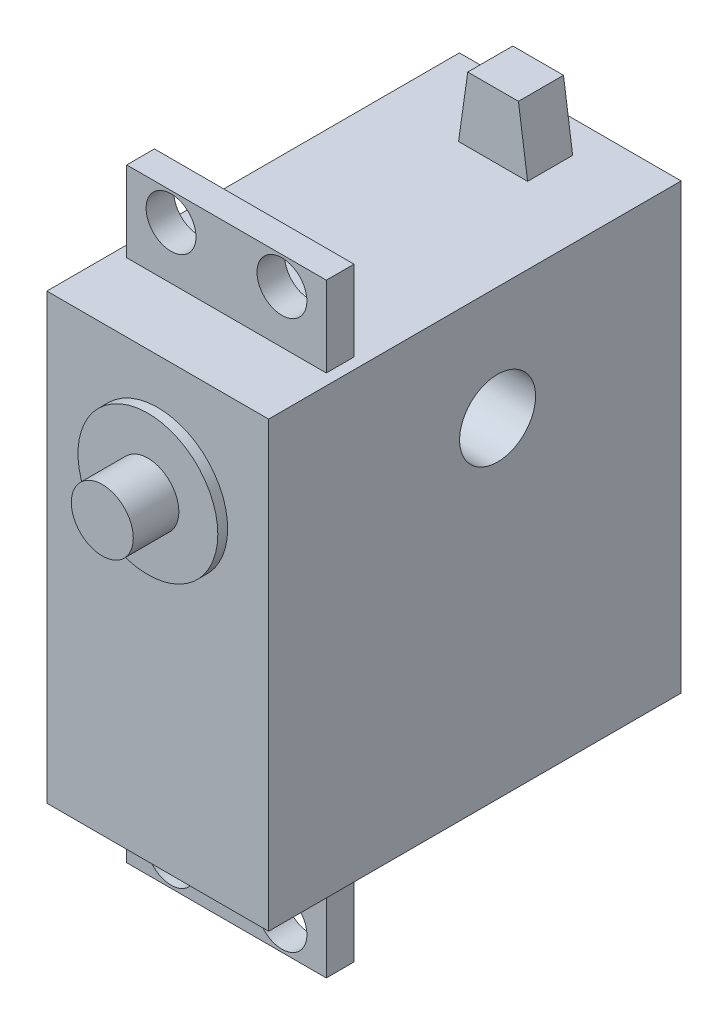
from build123d import *

# Parameters (mm, degrees)
SKETCH1_W           = 20
SKETCH1_H           = 40
BOSS_EXTRUDE1_DEPTH = 8.7
SKETCH2_W           = 20
SKETCH2_H           = 40
BOSS_EXTRUDE2_DEPTH = 28.5
SKETCH3_R           = 2.25
BOSS_EXTRUDE3_DEPTH = 2.5
SKETCH4_R           = 2.794
BOSS_EXTRUDE4_DEPTH = 5
BOSS_EXTRUDE6_DEPTH = 6.9596
SKETCH10_R          = 6.30555
BOSS_EXTRUDE7_DEPTH = 0.889
CUT_EXTRUDE1_DEPTH  = 2.8956
SKETCH15_R          = 3.424566538
CUT_EXTRUDE4_DEPTH  = 20


with BuildPart() as part:
    # Sketch1 → Boss-Extrude1 (new body)
    with BuildSketch(Plane.XY):
        with Locations((10, 20)):
            Rectangle(SKETCH1_W, SKETCH1_H)
    extrude(amount=BOSS_EXTRUDE1_DEPTH)

    # Sketch2 → Boss-Extrude2 (add)
    with BuildSketch(Plane(origin=(0, 0, 0), x_dir=(-1, 0, 0), z_dir=(0, 0, -1))):
        with Locations((-10, 20)):
            Rectangle(SKETCH2_W, SKETCH2_H)
    extrude(amount=BOSS_EXTRUDE2_DEPTH)

    # Sketch3 → Boss-Extrude3 (add)
    with BuildSketch(Plane.XY):
        Polygon((19, 0), (19, -7.25), (1, -7.25), (1, 0), (0, 0), (0, 40), (1, 40), (1, 47.25), (19, 47.25), (19, 40), (20, 40), (20, 0), align=None)
        with Locations((5, -4.75)):
            Circle(SKETCH3_R, mode=Mode.SUBTRACT)
        with Locations((15, -4.75)):
            Circle(SKETCH3_R, mode=Mode.SUBTRACT)
        with Locations((5, 44.75)):
            Circle(SKETCH3_R, mode=Mode.SUBTRACT)
        with Locations((15, 44.75)):
            Circle(SKETCH3_R, mode=Mode.SUBTRACT)
    extrude(amount=BOSS_EXTRUDE3_DEPTH)

    # Sketch4 → Boss-Extrude4 (add)
    with BuildSketch(Plane.XY.offset(8.7)):
        with Locations((10, 29.6)):
            Circle(SKETCH4_R)
    extrude(amount=BOSS_EXTRUDE4_DEPTH)

    # Sketch9 → Boss-Extrude6 (add)
    with BuildSketch(Plane(origin=(0, 0, -28.5), x_dir=(-1, 0, 0), z_dir=(0, 0, -1))):
        Polygon((-13.1115, 40), (-6.8885, 40), (-7.714, 45.842), (-12.286, 45.842), align=None)
    extrude(amount=-BOSS_EXTRUDE6_DEPTH)

    # Sketch10 → Boss-Extrude7 (add)
    with BuildSketch(Plane.XY.offset(8.7)):
        with Locations((10, 29.6)):
            Circle(SKETCH10_R)
    extrude(amount=BOSS_EXTRUDE7_DEPTH)

    # Sketch11 → Cut-Extrude1 (cut)
    with BuildSketch(Plane(origin=(0, 0, -28.5), x_dir=(-1, 0, 0), z_dir=(0, 0, -1))):
        Polygon((-12.286, 45.842), (-7.714, 45.842), (-6.8885, 40), (-13.1115, 40), align=None)
    extrude(amount=-CUT_EXTRUDE1_DEPTH, mode=Mode.SUBTRACT)

    # Sketch15 → Cut-Extrude4 (cut)
    with BuildSketch(Plane(origin=(20, 0, 0), x_dir=(0, 0, -1), z_dir=(1, 0, 0))):
        with Locations((11.945832328, 29.752689179)):
            Circle(SKETCH15_R)
    extrude(amount=-CUT_EXTRUDE4_DEPTH, mode=Mode.SUBTRACT)


solid = part.part
